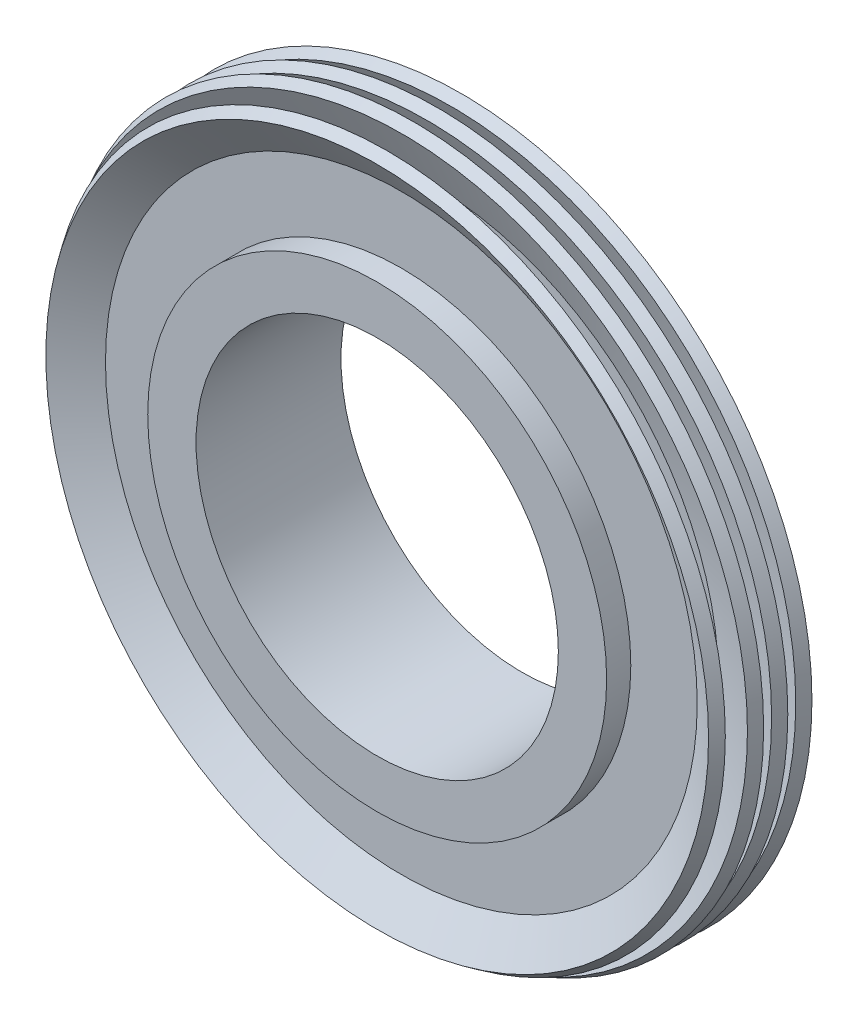
from build123d import *

# Parameters (mm, degrees)
ESBO_O1_R           = 19
ESBO_O1_R_2         = 15
CONTRA_CENTRO_DEPTH = 12
CHANFRO1_SIZE       = 3.5
CHANFRO1_SIZE2      = 2


with BuildPart() as part:
    # Esboço1 → CONTRA CENTRO (new body)
    with BuildSketch(Plane.XY):
        Circle(ESBO_O1_R)
        Circle(ESBO_O1_R_2, mode=Mode.SUBTRACT)
    extrude(amount=CONTRA_CENTRO_DEPTH)

    # Chanfro1
    chanfro1_edges = [part.edges().sort_by_distance(p)[0] for p in [
        (-19, 0, 0),
    ]]
    chanfro1_side = [part.faces().sort_by_distance(p)[0] for p in [
        (-18.462598846, 0, 0),
    ]]
    chamfer(chanfro1_edges, length=CHANFRO1_SIZE, length2=CHANFRO1_SIZE2, reference=chanfro1_side[0])

    # Esboço2 → AA26234 (revolve)
    with BuildSketch(Plane(origin=(0, 0, 0), x_dir=(0, 0, -1), z_dir=(1, 0, 0)), mode=Mode.PRIVATE) as aa26234_sk:
        Polygon((-2.5, 19), (-10, 19), (-10, 24.5), (-12, 27.437165192), (-11.173430596, 28), (-9, 24.808137652), (-9, 20), (-7.5, 20), (-7.5, 23.763932023), (-9.894427191, 28.552786405), (-9, 29), (-6.5, 24), (-6.5, 20), (-5.5, 20), (-5.5, 23.763932023), (-7.894427191, 28.552786405), (-7, 29), (-4.5, 24), (-4.5, 20), (-3.5, 20), (-3.5, 23.763932023), (-5.894427191, 28.552786405), (-5, 29), (-2.5, 24), align=None)
    revolve(aa26234_sk.sketch.rotate(Axis((0, 0, 10), (0, 0, -1)), 90), axis=Axis((0, 0, 10), (0, 0, -1)))


solid = part.part
